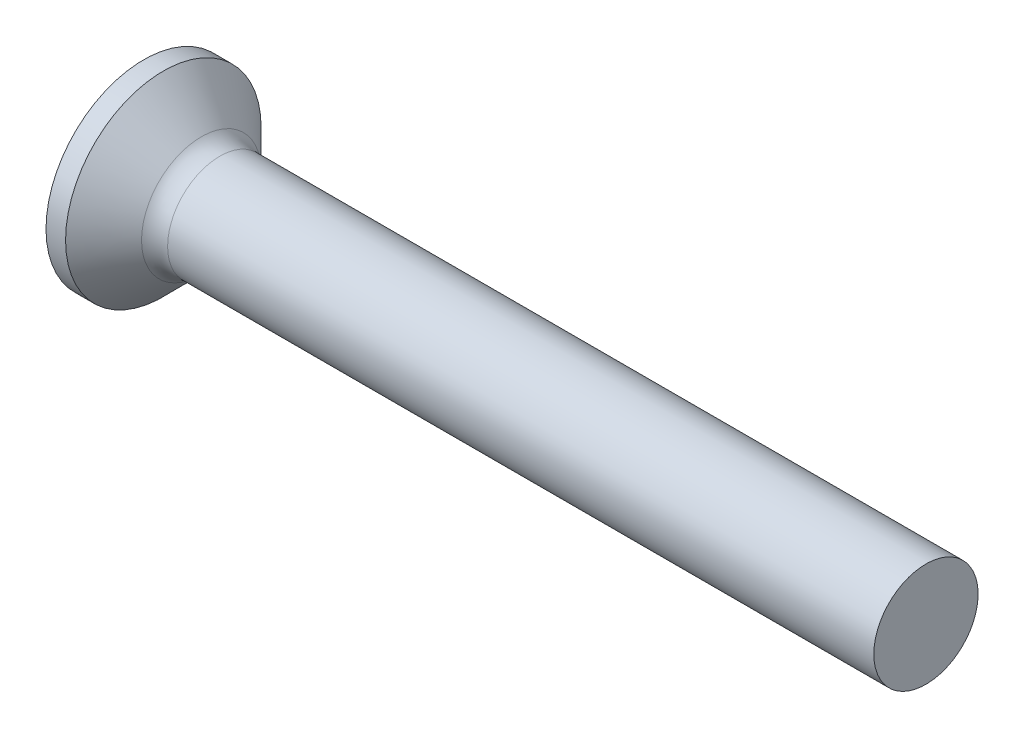
from build123d import *

# Parameters (mm, degrees)
FILLET1_R    = 0.4
RECPAT_COUNT = 2
RECPAT_ANGLE = 90


with BuildPart() as part:
    # BodySke → Base-Revolve (revolve)
    with BuildSketch(Plane.XY, mode=Mode.PRIVATE) as base_revolve_sk:
        Polygon((0, 0), (0, 1.5), (0.3, 1.5), (1, 0.8), (12, 0.8), (12, 0), align=None)
    revolve(base_revolve_sk.sketch.rotate(Axis((-6.35, 0, 0), (1, 0, 0)), 90), axis=Axis((-6.35, 0, 0), (1, 0, 0)))

    # Fillet1
    fillet1_edges = [part.edges().sort_by_distance(p)[0] for p in [
        (1, 0, -0.8),
    ]]
    fillet(fillet1_edges, radius=FILLET1_R)

    # Sketch3 → Recess section 0
    with BuildSketch(Plane.ZY):
        with BuildLine():
            Line((-0.24, 0.8), (0.24, 0.8))
            Line((0.24, 0.8), (0.24, -0.8))
            Line((0.24, -0.8), (-0.24, -0.8))
            Line((-0.24, -0.8), (-0.24, 0.8))
        make_face()
    # Sketch4 → Recess section 1
    with BuildSketch(Plane.ZY.offset(-0.95)):
        with BuildLine():
            Line((-0.24, 0.326347489), (0.24, 0.326347489))
            Line((0.24, 0.326347489), (0.24, -0.326347489))
            Line((0.24, -0.326347489), (-0.24, -0.326347489))
            Line((-0.24, -0.326347489), (-0.24, 0.326347489))
        make_face()
    recess = loft(mode=Mode.SUBTRACT)

    # RecPat: Recess ×2 about axis
    recpat_axis = Axis((0, 0, 0), (1, 0, 0))
    for i in range(1, RECPAT_COUNT):
        add(recess.rotate(recpat_axis, i * RECPAT_ANGLE / (RECPAT_COUNT - 1)), mode=Mode.SUBTRACT)

    # RecCorSke → RecessCore (revolve, cut)
    with BuildSketch(Plane.XY, mode=Mode.PRIVATE) as recesscore_sk:
        Polygon((0, 0), (0, 0.421930471), (0.95, 0.3555), (1.065508952, 0), align=None)
    revolve(recesscore_sk.sketch.rotate(Axis((-3.175, 0, 0), (1, 0, 0)), 90), axis=Axis((-3.175, 0, 0), (1, 0, 0)), mode=Mode.SUBTRACT)


solid = part.part
